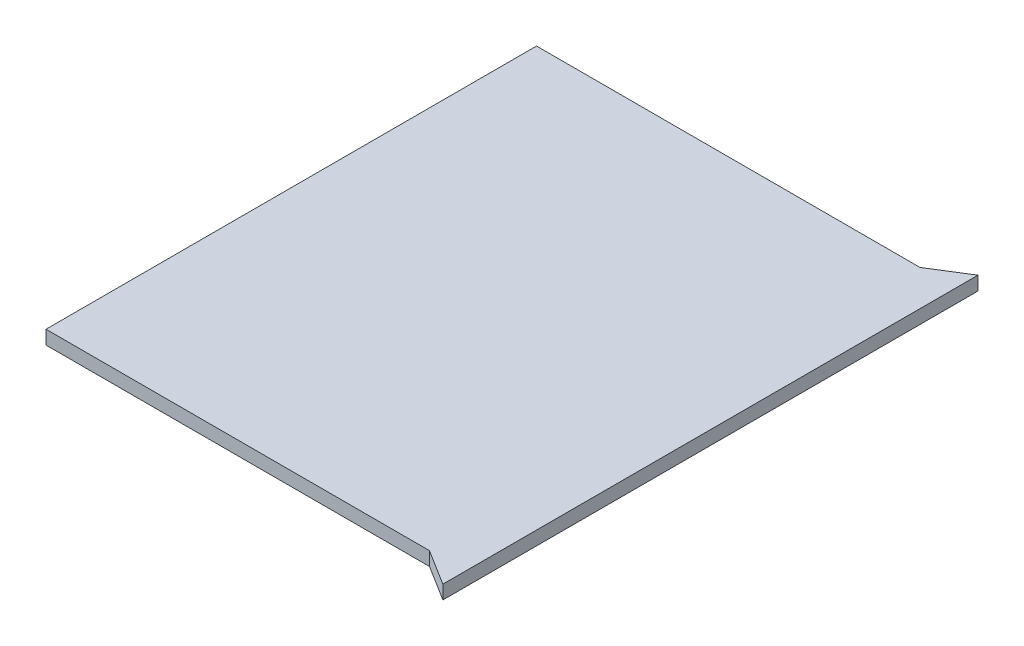
from build123d import *

# Parameters (mm, degrees)
BOSS_EXTRUDE2_DEPTH = 1.54


with BuildPart() as part:
    # Sketch1 → Boss-Extrude2 (new body)
    with BuildSketch(Plane(origin=(0, 0, 0), x_dir=(1, 0, 0), z_dir=(0, 1, 0))):
        Polygon((-21.5, -27.5), (21.5, -27.5), (25.5, -30), (25.5, 30), (21.5, 27.5), (-21.5, 27.5), align=None)
    extrude(amount=BOSS_EXTRUDE2_DEPTH)


solid = part.part
